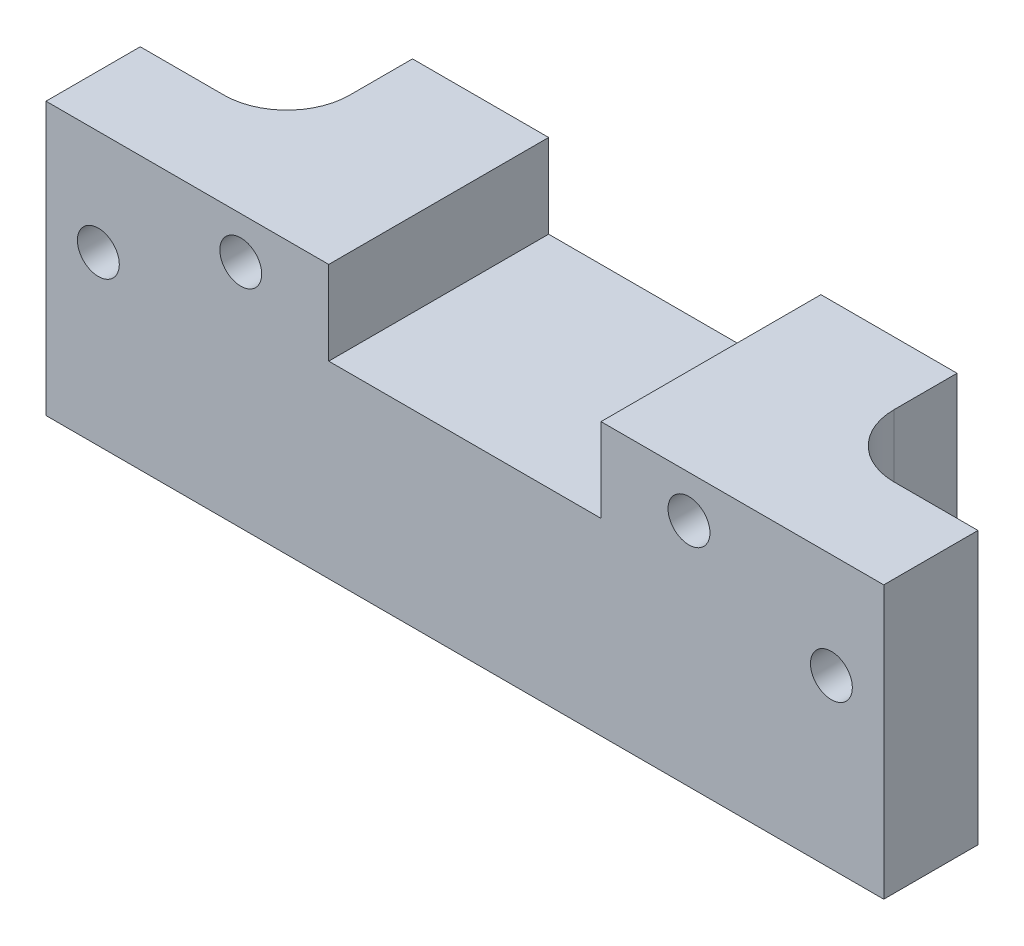
from build123d import *

# Parameters (mm, degrees)
SKETCH_2_W          = 40
SKETCH_2_H          = 13
EXTRUDE_1_DEPTH     = 9.5
SKETCH_3_R          = 1
CUT_EXTRUDE_1_DEPTH = 10
SKETCH_4_R          = 1
SKETCH_4_W          = 13
SKETCH_4_H          = 4
CUT_EXTRUDE_2_DEPTH = 10
SKETCH_5_W          = 7
SKETCH_5_H          = 13
CUT_EXTRUDE_3_DEPTH = 5
FILLET_1_R          = 3
EXTRUDE_START       = 1
SKETCH_6_R          = 1
EXTRUDE_2_DEPTH     = 1


with BuildPart() as part:
    # 草图2 → 凸台-拉伸1 (new body)
    with BuildSketch(Plane.XY):
        Rectangle(SKETCH_2_W, SKETCH_2_H)
    extrude(amount=EXTRUDE_1_DEPTH)

    # 草图3 → 切除-拉伸1 (cut)
    with BuildSketch(Plane(origin=(0, 0, 0), x_dir=(-1, 0, 0), z_dir=(0, 0, -1))):
        with Locations((-17.5, 1.5)):
            Circle(SKETCH_3_R)
        with Locations(Location((17.5, 1.5, 0), (0, 0, 180))):
            Circle(SKETCH_3_R)
    extrude(amount=-CUT_EXTRUDE_1_DEPTH, mode=Mode.SUBTRACT)

    # 草图4 → 切除-拉伸2 (cut)
    with BuildSketch(Plane(origin=(0, 0, 0), x_dir=(-1, 0, 0), z_dir=(0, 0, -1))):
        with Locations((-10.7, 4.5)):
            Circle(SKETCH_4_R)
        with Locations(Location((10.7, 4.5, 0), (0, 0, 180))):
            Circle(SKETCH_4_R)
        with Locations((0, 4.5)):
            Rectangle(SKETCH_4_W, SKETCH_4_H)
    extrude(amount=-CUT_EXTRUDE_2_DEPTH, mode=Mode.SUBTRACT)

    # 草图5 → 切除-拉伸3 (cut)
    with BuildSketch(Plane(origin=(0, 0, 0), x_dir=(-1, 0, 0), z_dir=(0, 0, -1))):
        with Locations((-16.5, 0)):
            Rectangle(SKETCH_5_W, SKETCH_5_H)
        with Locations((16.5, 0)):
            Rectangle(SKETCH_5_W, SKETCH_5_H)
    extrude(amount=-CUT_EXTRUDE_3_DEPTH, mode=Mode.SUBTRACT)

    # 圆角1
    fillet_1_edges = [part.edges().sort_by_distance(p)[0] for p in [
        (13, 0, 5),
        (-13, 0, 5),
    ]]
    fillet(fillet_1_edges, radius=FILLET_1_R)

    # 草图6 → 凸台-拉伸2 (add)
    with BuildSketch(Plane(origin=(0, 0, 0), x_dir=(-1, 0, 0), z_dir=(0, 0, -1)).offset(EXTRUDE_START)):
        Polygon((-13, -2.5), (13, -2.5), (13, 6.5), (6.5, 6.5), (6.5, 2.5), (-6.5, 2.5), (-6.5, 6.5), (-13, 6.5), align=None)
        with Locations((-10.7, 4.5)):
            Circle(SKETCH_6_R, mode=Mode.SUBTRACT)
        with Locations((10.7, 4.5)):
            Circle(SKETCH_6_R, mode=Mode.SUBTRACT)
    extrude(amount=-EXTRUDE_2_DEPTH)


solid = part.part
